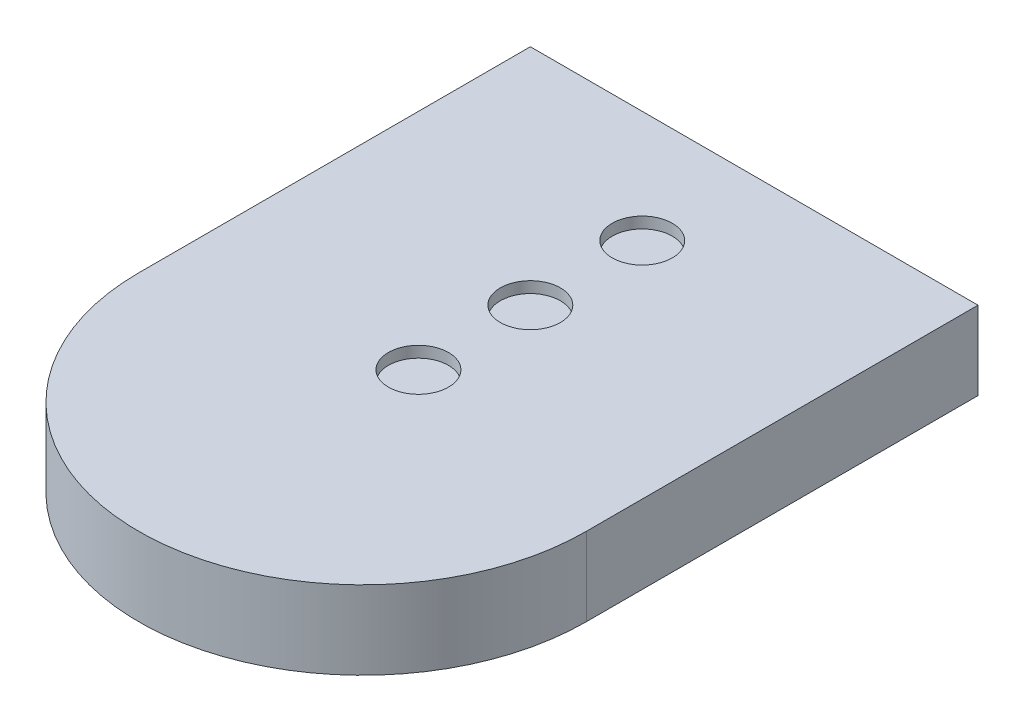
from build123d import *

# Parameters (mm, degrees)
SKETCH1_W           = 40
SKETCH1_H           = 7
BOSS_EXTRUDE1_DEPTH = 55
SKETCH2_R           = 2.684543284
CUT_EXTRUDE1_DEPTH  = 7
FILLET1_RADIUS      = 20
FILLET1_LENGTH      = 7
SKETCH4_W           = 20
SKETCH4_H           = 5
CUT_EXTRUDE2_DEPTH  = 40


with BuildPart() as part:
    # Sketch1 → Boss-Extrude1 (new body)
    with BuildSketch(Plane.XY):
        with Locations((20, -3.5)):
            Rectangle(SKETCH1_W, SKETCH1_H)
    extrude(amount=BOSS_EXTRUDE1_DEPTH)

    # Sketch2 → Cut-Extrude1 (cut)
    with BuildSketch(Plane(origin=(0, 0, 0), x_dir=(1, 0, 0), z_dir=(0, 1, 0))):
        with Locations(Location((20, -10, 0), (0, 0, 270))):
            Circle(SKETCH2_R)
        with Locations(Location((20, -20, 0), (0, 0, 270))):
            Circle(SKETCH2_R)
        with Locations(Location((20, -30, 0), (0, 0, 270))):
            Circle(SKETCH2_R)
    extrude(amount=-CUT_EXTRUDE1_DEPTH, mode=Mode.SUBTRACT)

    # Fillet1: full round fillet: the end face becomes a half cylinder, R = half its width
    fillet1_face = Plane((20, -3.5, 55), x_dir=(0, 1, 0), z_dir=(0, 0, 1))  # on the end face: x along it, z out of the body
    fillet1_slab = fillet1_face.offset(-FILLET1_RADIUS / 2) * Box(FILLET1_LENGTH, 2 * FILLET1_RADIUS, FILLET1_RADIUS, mode=Mode.PRIVATE)  # the body's end, R deep
    fillet1_round = Plane((20, -3.5, 35), x_dir=(0, 0, 1), z_dir=(0, 1, 0)) * Cylinder(FILLET1_RADIUS, FILLET1_LENGTH, mode=Mode.PRIVATE)  # its axis R under the face
    add(fillet1_slab - fillet1_round, mode=Mode.SUBTRACT)

    # Sketch4 → Cut-Extrude2 (cut)
    with BuildSketch(Plane(origin=(0, 0, 0), x_dir=(-1, 0, 0), z_dir=(0, 0, -1))):
        with Locations((-20, -3.5)):
            Rectangle(SKETCH4_W, SKETCH4_H)
    extrude(amount=-CUT_EXTRUDE2_DEPTH, mode=Mode.SUBTRACT)


solid = part.part
